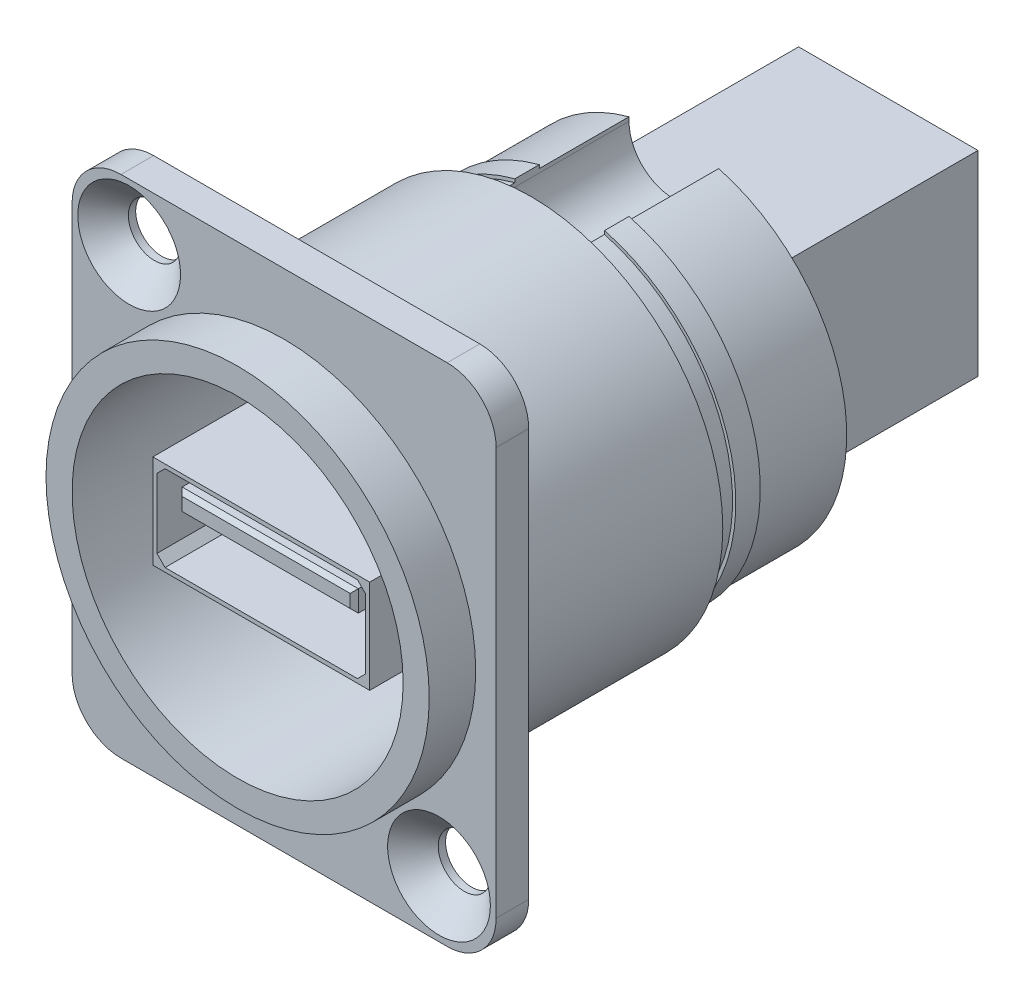
from build123d import *

# Parameters (mm, degrees)
SKETCH1_R                                     = 10.8
EXTRUDE1_DEPTH                                = 0.75
SKETCH2_R                                     = 10.6
EXTRUDE2_DEPTH                                = 5.5
EXTRUDE3_START                                = 5.5
SKETCH3_R                                     = 10.6
EXTRUDE3_DEPTH                                = 5.5
SKETCH4_W                                     = 16
SKETCH4_H                                     = 9
EXTRUDE4_DEPTH                                = 2
SKETCH5_W                                     = 13.3
SKETCH5_H                                     = 5.75
EXTRUDE5_DEPTH                                = 10.8
EXTRUDE6_DEPTH                                = 10.8
SKETCH7_W                                     = 10.8
SKETCH7_H                                     = 1.3
EXTRUDE7_DEPTH                                = 10.5
CHAMFER1_SIZE                                 = 0.25
SKETCH8_W                                     = 11
SKETCH8_H                                     = 12
EXTRUDE8_DEPTH                                = 13.15
EXTRUDE9_DEPTH                                = 13.15
SKETCH10_W                                    = 5.5
SKETCH10_H                                    = 3
EXTRUDE10_DEPTH                               = 13
CHAMFER2_SIZE                                 = 0.25
EXTRUDE11_DEPTH                               = 30.552834043
SKETCH12_R                                    = 10.15
EXTRUDE12_DEPTH                               = 1.25
EXTRUDE13_DEPTH                               = 13
EXTRUDE13_DEPTH_BACK                          = 5
SKETCH13_R                                    = 11.75
SKETCH13_R_2                                  = 10.15
SKETCH14_W                                    = 26
SKETCH14_H                                    = 31
SKETCH14_R                                    = 11.75
EXTRUDE14_DEPTH                               = 2
CSK_FOR_M3_COUNTERSUNK_FLAT_HEAD1_D           = 3.2
CSK_FOR_M3_COUNTERSUNK_FLAT_HEAD1_CSINK_D     = 6.3
CSK_FOR_M3_COUNTERSUNK_FLAT_HEAD1_CSINK_ANGLE = 90
FILLET1_R                                     = 3


with BuildPart() as part:
    # Sketch1 → Extrude1 (new, symmetric)
    with BuildSketch(Plane.XY):
        Circle(SKETCH1_R)
    extrude(amount=EXTRUDE1_DEPTH, both=True)

    # Sketch2 → Extrude2 (add)
    with BuildSketch(Plane.XY.offset(0.75)):
        Circle(SKETCH2_R)
    extrude(amount=EXTRUDE2_DEPTH)

    # Sketch3 → Extrude3 (add)
    with BuildSketch(Plane(origin=(0, 0, -0.75), x_dir=(-1, 0, 0), z_dir=(0, 0, -1)).offset(EXTRUDE3_START)):
        with Locations(Location((0, 0, 0), (0, 0, 180))):
            Circle(SKETCH3_R)
    extrude(amount=-EXTRUDE3_DEPTH)

    # Sketch4 → Extrude4 (add)
    with BuildSketch(Plane.XY.offset(6.25)):
        Rectangle(SKETCH4_W, SKETCH4_H)
    extrude(amount=EXTRUDE4_DEPTH)

    # Sketch5 → Extrude5 (add)
    with BuildSketch(Plane.XY.offset(8.25)):
        Rectangle(SKETCH5_W, SKETCH5_H)
    extrude(amount=EXTRUDE5_DEPTH)

    # Sketch6 → Extrude6 (cut)
    with BuildSketch(Plane.XY.offset(19.05)):
        Polygon((-5.9, 2.625), (5.9, 2.625), (6.4, 2.125), (6.4, -2.125), (5.9, -2.625), (-5.9, -2.625), (-6.4, -2.125), (-6.4, 2.125), align=None)
    extrude(amount=-EXTRUDE6_DEPTH, mode=Mode.SUBTRACT)

    # Sketch7 → Extrude7 (add)
    with BuildSketch(Plane.XY.offset(8.25)):
        with Locations((0, 0.975)):
            Rectangle(SKETCH7_W, SKETCH7_H)
    extrude(amount=EXTRUDE7_DEPTH)

    # Chamfer1
    chamfer1_edges = [part.edges().sort_by_distance(p)[0] for p in [
        (-5.4, 0.975, 18.75),
        (0, 0.325, 18.75),
        (5.4, 0.975, 18.75),
        (0, 1.625, 18.75),
    ]]
    chamfer(chamfer1_edges, length=CHAMFER1_SIZE)

    # Sketch8 → Extrude8 (add)
    with BuildSketch(Plane(origin=(0, 0, -6.25), x_dir=(-1, 0, 0), z_dir=(0, 0, -1))):
        Rectangle(SKETCH8_W, SKETCH8_H)
    extrude(amount=EXTRUDE8_DEPTH)

    # Sketch9 → Extrude9 (cut)
    with BuildSketch(Plane(origin=(0, 0, -19.4), x_dir=(-1, 0, 0), z_dir=(0, 0, -1))):
        Polygon((-2.85, 4.6), (2.85, 4.6), (3.85, 3.6), (3.85, -4.35), (-3.85, -4.35), (-3.85, 3.6), align=None)
    extrude(amount=-EXTRUDE9_DEPTH, mode=Mode.SUBTRACT)

    # Sketch10 → Extrude10 (add)
    with BuildSketch(Plane(origin=(0, 0, -6.25), x_dir=(-1, 0, 0), z_dir=(0, 0, -1))):
        Rectangle(SKETCH10_W, SKETCH10_H)
    extrude(amount=EXTRUDE10_DEPTH)

    # Chamfer2
    chamfer2_edges = [part.edges().sort_by_distance(p)[0] for p in [
        (2.75, 0, -19.25),
        (0, -1.5, -19.25),
        (-2.75, 0, -19.25),
        (0, 1.5, -19.25),
    ]]
    chamfer(chamfer2_edges, length=CHAMFER2_SIZE)

    # Sketch11 → Extrude11 (cut, through all)
    with BuildSketch(Plane(origin=(0, 0, -6.25), x_dir=(-1, 0, 0), z_dir=(0, 0, -1))):
        with BuildLine():
            Line((-2.75, 10), (-2.75, 10.444017426))
            ThreePointArc((-2.75, 10.444017426), (0, 10.8), (2.75, 10.444017426))
            Line((2.75, 10.444017426), (2.75, 10))
            ThreePointArc((2.75, 10), (0, 7.25), (-2.75, 10))
        make_face()
        with BuildLine():
            Line((-2.75, -10.444017426), (-2.75, -10))
            ThreePointArc((-2.75, -10), (0, -7.25), (2.75, -10))
            Line((2.75, -10), (2.75, -10.444017426))
            ThreePointArc((2.75, -10.444017426), (0, -10.8), (-2.75, -10.444017426))
        make_face()
    extrude(amount=-EXTRUDE11_DEPTH, mode=Mode.SUBTRACT)

    # Sketch12 → Extrude12 (add)
    with BuildSketch(Plane.XY.offset(6.25)):
        with Locations(Location((0, 0, 0), (0, 0, 105.664941507))):
            Circle(SKETCH12_R)
        Polygon((7.3, 4.8), (8.3, 4.8), (8.3, -4.8), (7.3, -4.8), (7.3, -5.25), (-7.3, -5.25), (-7.3, -4.8), (-8.3, -4.8), (-8.3, 4.8), (-7.3, 4.8), (-7.3, 5.25), (7.3, 5.25), align=None, mode=Mode.SUBTRACT)
    extrude(amount=EXTRUDE12_DEPTH)

    # Sketch13 → Extrude13 (add, two sides: drawn at the far end of the back side and taken through both)
    with BuildSketch(Plane.XY.offset(7.5).offset(-EXTRUDE13_DEPTH_BACK)):
        Circle(SKETCH13_R)
        Circle(SKETCH13_R_2, mode=Mode.SUBTRACT)
    extrude(amount=EXTRUDE13_DEPTH + EXTRUDE13_DEPTH_BACK)

    # Sketch14 → Extrude14 (add)
    with BuildSketch(Plane.XY.offset(17.65)):
        Rectangle(SKETCH14_W, SKETCH14_H)
        Circle(SKETCH14_R, mode=Mode.SUBTRACT)
    extrude(amount=-EXTRUDE14_DEPTH)

    # CSK for M3 Countersunk Flat Head1 (through all)
    with Locations(Plane.XY.offset(17.65)):
        with Locations((-9.5, 12), (9.5, -12)):
            CounterSinkHole(CSK_FOR_M3_COUNTERSUNK_FLAT_HEAD1_D / 2, CSK_FOR_M3_COUNTERSUNK_FLAT_HEAD1_CSINK_D / 2, counter_sink_angle=CSK_FOR_M3_COUNTERSUNK_FLAT_HEAD1_CSINK_ANGLE)

    # Fillet1
    fillet1_edges = [part.edges().sort_by_distance(p)[0] for p in [
        (-13, -15.5, 16.65),
        (-13, 15.5, 16.65),
        (13, 15.5, 16.65),
        (13, -15.5, 16.65),
    ]]
    fillet(fillet1_edges, radius=FILLET1_R)


solid = part.part
